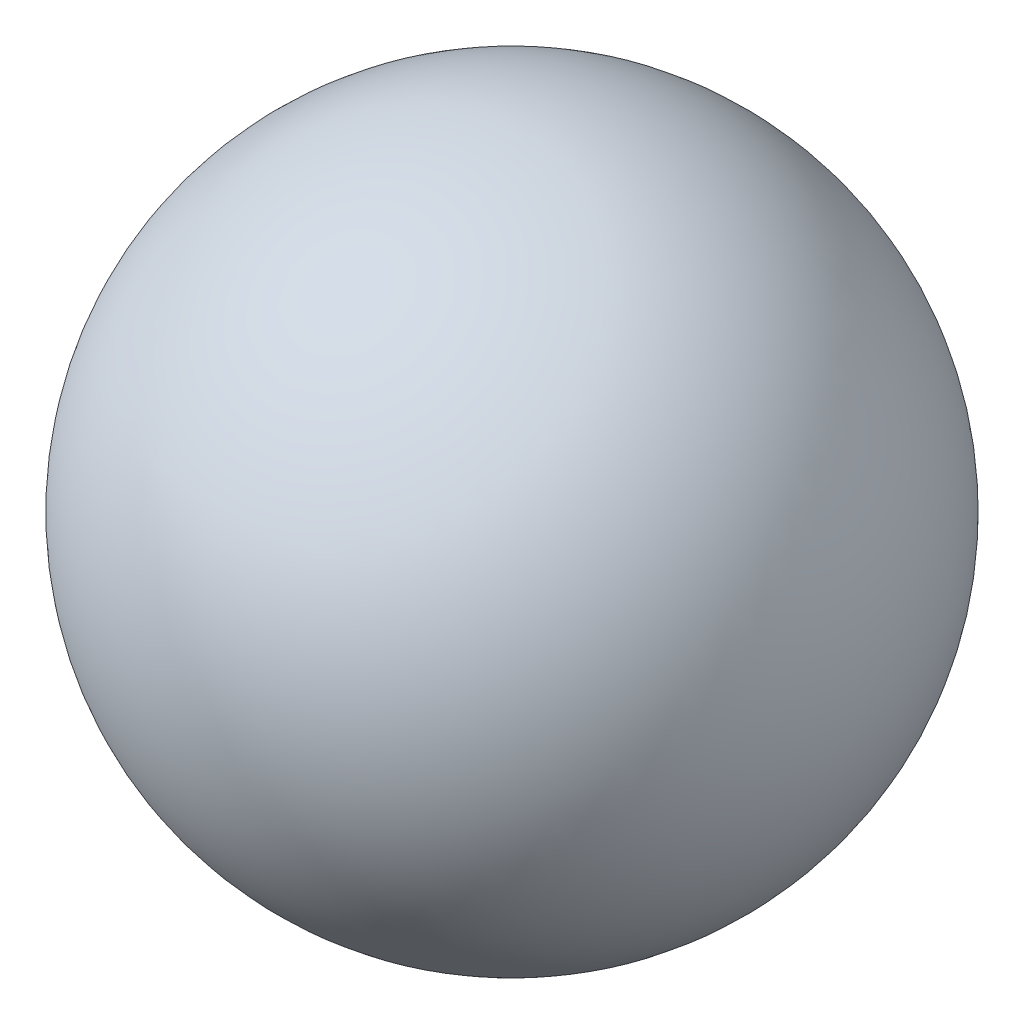
from build123d import *


with BuildPart() as part:
    # Croquis1 → Revolución1 (revolve)
    with BuildSketch(Plane.XY):
        with BuildLine():
            Line((0, 0.3), (0, -0.3))
            ThreePointArc((0, -0.3), (0.3, 0), (0, 0.3))
        make_face()
    revolve(axis=Axis((0, -0.15, 0), (0, 1, 0)))


solid = part.part
